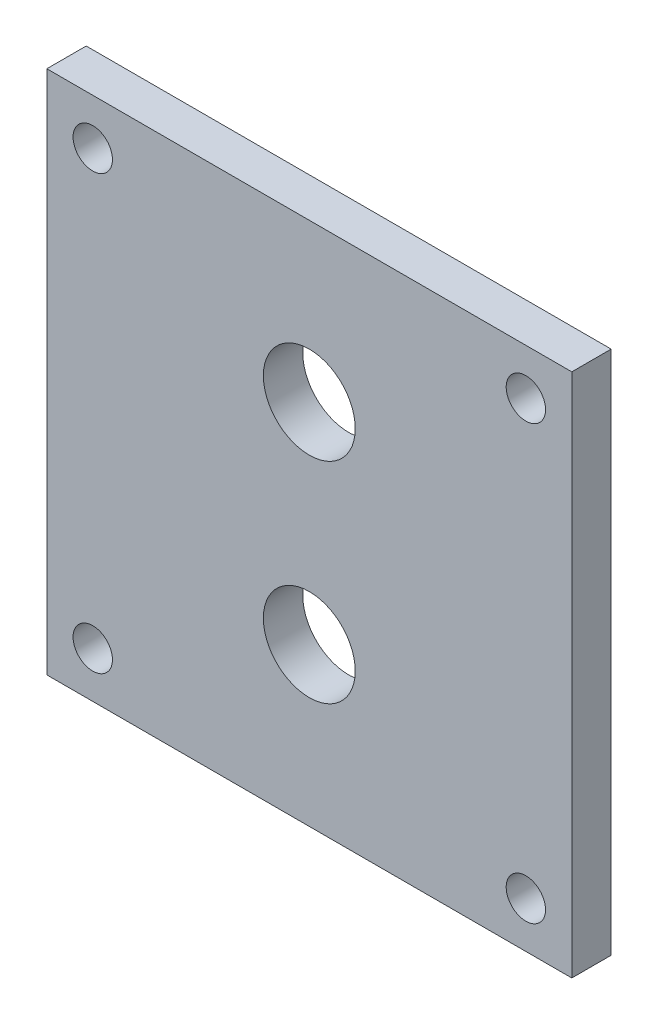
from build123d import *

# Parameters (mm, degrees)
SKETCH1_W           = 127
SKETCH1_H           = 127
BOSS_EXTRUDE1_DEPTH = 9.525
SKETCH2_R           = 11.1125
CUT_EXTRUDE1_DEPTH  = 9.525
SKETCH3_R           = 4.7625
CUT_EXTRUDE2_DEPTH  = 9.525


with BuildPart() as part:
    # Sketch1 → Boss-Extrude1 (new body)
    with BuildSketch(Plane.XY):
        Rectangle(SKETCH1_W, SKETCH1_H)
    extrude(amount=BOSS_EXTRUDE1_DEPTH)

    # Sketch2 → Cut-Extrude1 (cut)
    with BuildSketch(Plane(origin=(0, 0, 0), x_dir=(-1, 0, 0), z_dir=(0, 0, -1))):
        with Locations((0, 25.4)):
            Circle(SKETCH2_R)
        with Locations((0, -25.4)):
            Circle(SKETCH2_R)
    extrude(amount=-CUT_EXTRUDE1_DEPTH, mode=Mode.SUBTRACT)

    # Sketch3 → Cut-Extrude2 (cut)
    with BuildSketch(Plane(origin=(0, 0, 0), x_dir=(-1, 0, 0), z_dir=(0, 0, -1))):
        with Locations((52.3875, 52.3875)):
            Circle(SKETCH3_R)
        with Locations((52.3875, -52.3875)):
            Circle(SKETCH3_R)
        with Locations((-52.3875, 52.3875)):
            Circle(SKETCH3_R)
        with Locations((-52.3875, -52.3875)):
            Circle(SKETCH3_R)
    extrude(amount=-CUT_EXTRUDE2_DEPTH, mode=Mode.SUBTRACT)


solid = part.part
